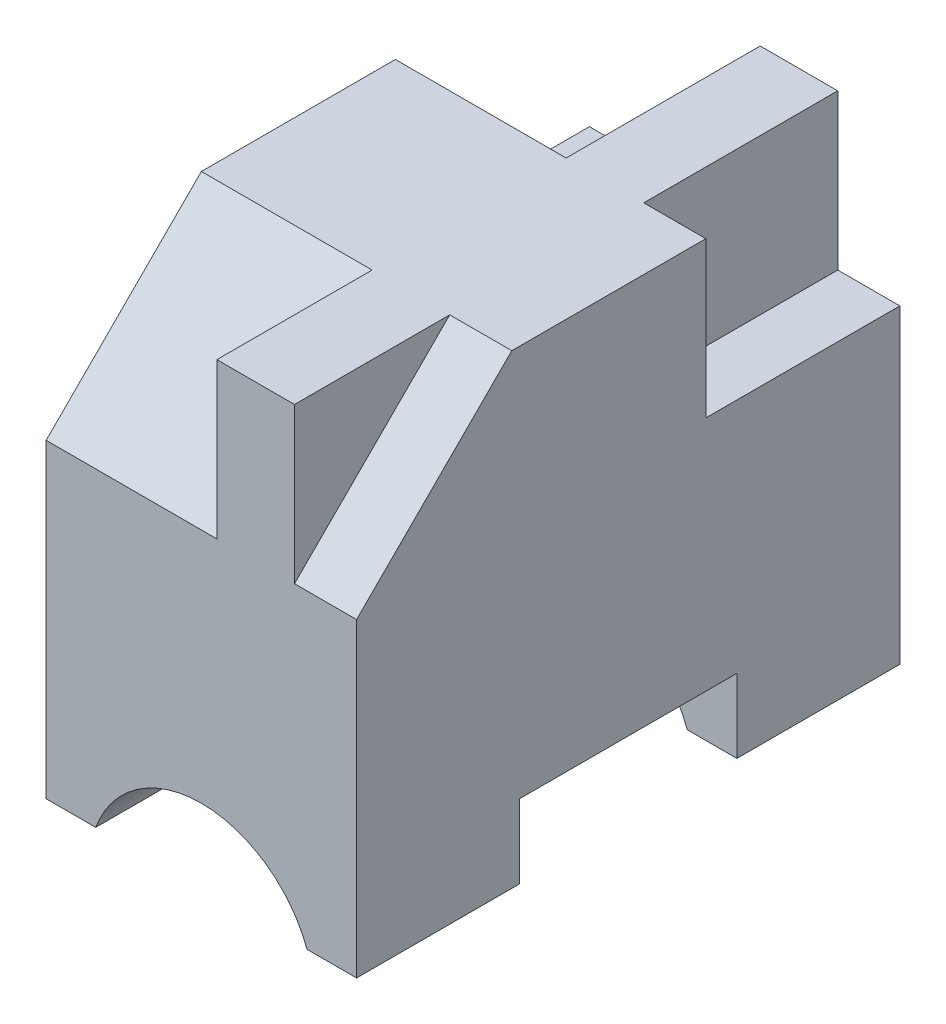
from build123d import *

# Parameters (mm, degrees)
EXTRUDE_1_DEPTH     = 70
SKETCH_2_W          = 28
SKETCH_2_H          = 9.5
CUT_EXTRUDE_1_DEPTH = 87.02325267
SKETCH_3_W          = 25
SKETCH_3_H          = 20
CUT_EXTRUDE_2_DEPTH = 8
CUT_EXTRUDE_START   = -18
SKETCH_3_2_W        = 25
SKETCH_3_2_H        = 20
CUT_EXTRUDE_3_DEPTH = 69.02325267


with BuildPart() as part:
    # Эскиз1 → Бобышка-Вытянуть1 (new body)
    with BuildSketch(Plane.XY):
        with BuildLine():
            Line((-20, 30), (-20, -30))
            Line((-20, -30), (-13.610657589, -30))
            ThreePointArc((-13.610657589, -30), (0, -20.5), (13.610657589, -30))
            Line((13.610657589, -30), (20, -30))
            Line((20, -30), (20, 30))
            Line((20, 30), (-20, 30))
        make_face()
    extrude(amount=EXTRUDE_1_DEPTH)

    # Эскиз2 → Вырез-Вытянуть1 (cut, through all)
    with BuildSketch(Plane.ZY.offset(20)):
        with Locations((35, -25.25)):
            Rectangle(SKETCH_2_W, SKETCH_2_H)
    extrude(amount=-CUT_EXTRUDE_1_DEPTH, mode=Mode.SUBTRACT)

    # Эскиз3 → Вырез-Вытянуть2 (cut)
    with BuildSketch(Plane(origin=(20, 0, 0), x_dir=(0, 0, -1), z_dir=(1, 0, 0))):
        Polygon((-70, 30), (-70, 10), (-50, 30), align=None)
        with Locations((-12.5, 20)):
            Rectangle(SKETCH_3_W, SKETCH_3_H)
    extrude(amount=-CUT_EXTRUDE_2_DEPTH, mode=Mode.SUBTRACT)

    # Эскиз3<2> → Вырез-Вытянуть3 (cut, through all)
    with BuildSketch(Plane(origin=(20, 0, 0), x_dir=(0, 0, -1), z_dir=(1, 0, 0)).offset(CUT_EXTRUDE_START)):
        Polygon((-70, 30), (-70, 10), (-50, 30), align=None)
        with Locations((-12.5, 20)):
            Rectangle(SKETCH_3_2_W, SKETCH_3_2_H)
    extrude(amount=-CUT_EXTRUDE_3_DEPTH, mode=Mode.SUBTRACT)


solid = part.part
